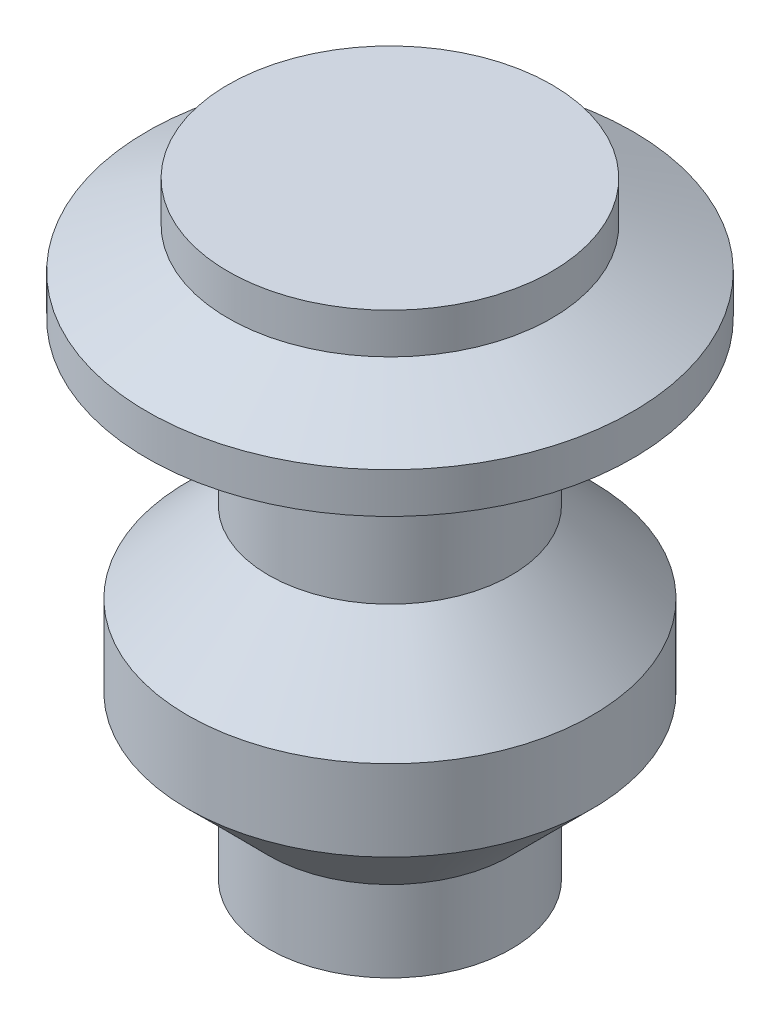
from build123d import *


with BuildPart() as part:
    # 草图1 → 旋转1 (revolve)
    with BuildSketch(Plane.XY, mode=Mode.PRIVATE) as revolve_1_sk:
        Polygon((30, 0), (30, 20), (50, 40), (50, 60), (30, 80), (30, 100), (60, 120), (60, 130), (40, 140), (40, 150), (0, 150), (0, 0), align=None)
    revolve(revolve_1_sk.sketch.rotate(Axis((0, 0, 0), (0, 1, 0)), 90), axis=Axis((0, 0, 0), (0, 1, 0)))


solid = part.part
